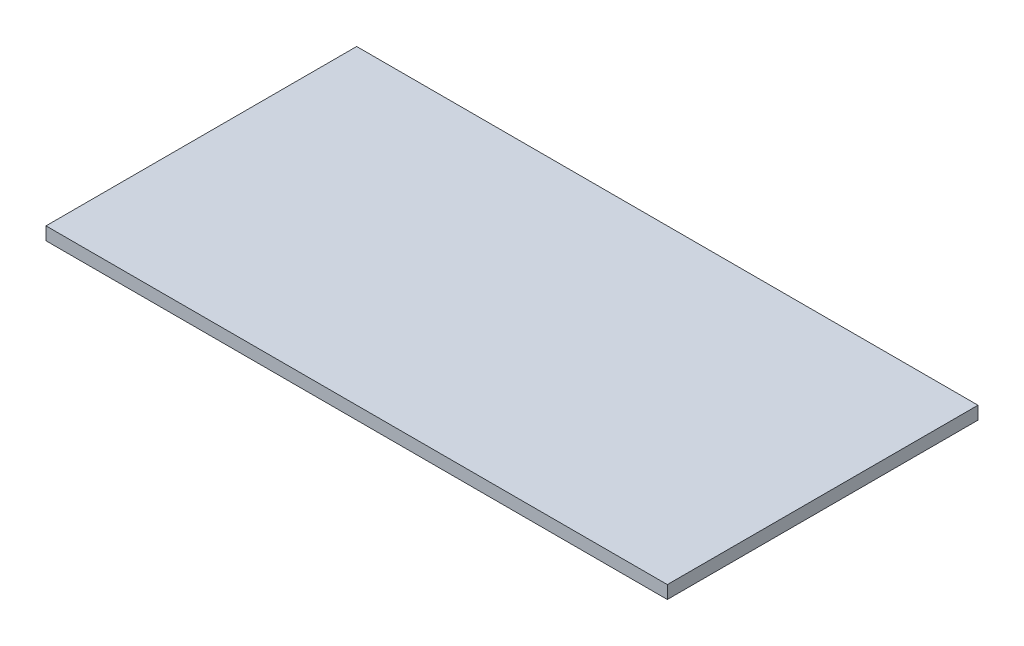
from build123d import *

# Parameters (mm, degrees)
SKETCH1_W           = 609.6
SKETCH1_H           = 304.8
BOSS_EXTRUDE1_DEPTH = 12.7


with BuildPart() as part:
    # Sketch1 → Boss-Extrude1 (new body)
    with BuildSketch(Plane(origin=(0, 0, 0), x_dir=(1, 0, 0), z_dir=(0, 1, 0))):
        Rectangle(SKETCH1_W, SKETCH1_H)
    extrude(amount=BOSS_EXTRUDE1_DEPTH)


solid = part.part
